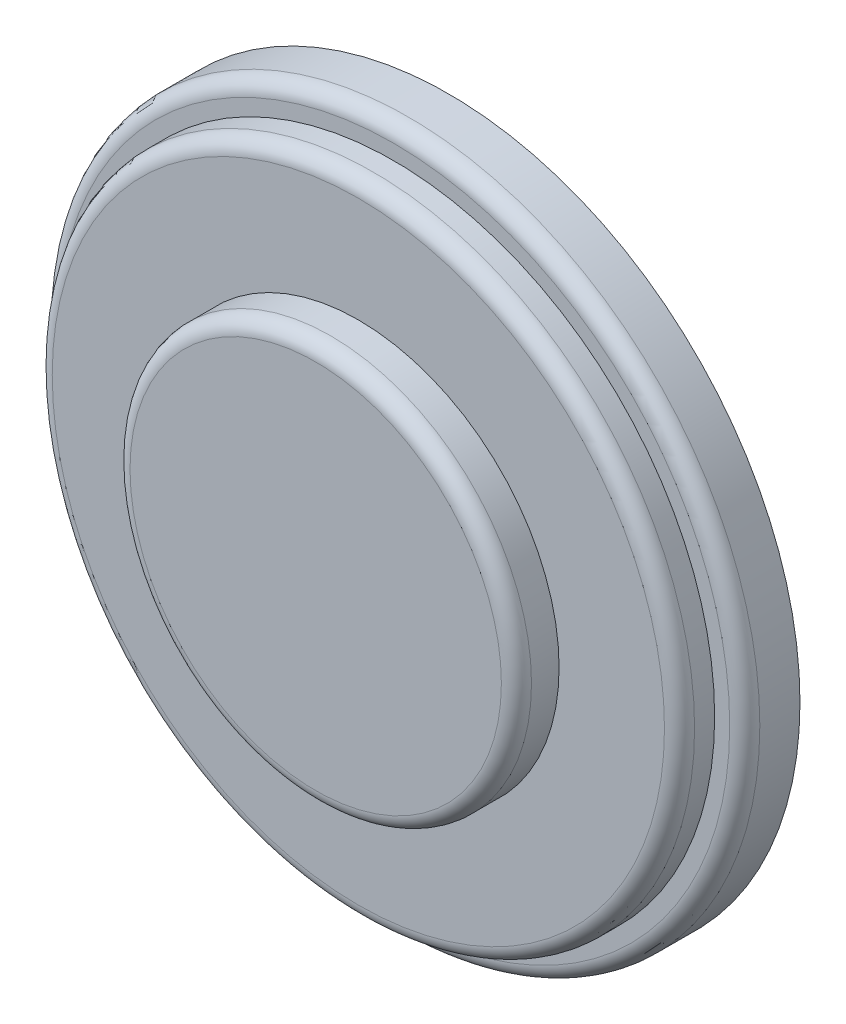
from build123d import *

# Parameters (mm, degrees)
ESQUISSE1_R             = 14
BOSS_EXTRU_1_DEPTH      = 2.2
ESQUISSE2_R             = 12.8
BOSS_EXTRU_2_DEPTH      = 1.4
ESQUISSE3_R             = 8
BOSS_EXTRU_3_DEPTH      = 1.7
ESQUISSE4_R             = 12.5
ENL_V_MAT_EXTRU_1_DEPTH = 1
CONG_1_R                = 0.6


with BuildPart() as part:
    # Esquisse1 → Boss.-Extru.1 (new body)
    with BuildSketch(Plane.XY):
        Circle(ESQUISSE1_R)
    extrude(amount=BOSS_EXTRU_1_DEPTH)

    # Esquisse2 → Boss.-Extru.2 (add)
    with BuildSketch(Plane.XY.offset(2.2)):
        Circle(ESQUISSE2_R)
    extrude(amount=BOSS_EXTRU_2_DEPTH)

    # Esquisse3 → Boss.-Extru.3 (add)
    with BuildSketch(Plane.XY.offset(3.6)):
        Circle(ESQUISSE3_R)
    extrude(amount=BOSS_EXTRU_3_DEPTH)

    # Esquisse4 → Enlèv. mat.-Extru.1 (cut)
    with BuildSketch(Plane(origin=(0, 0, 0), x_dir=(-1, 0, 0), z_dir=(0, 0, -1))):
        Circle(ESQUISSE4_R)
    extrude(amount=-ENL_V_MAT_EXTRU_1_DEPTH, mode=Mode.SUBTRACT)

    # Congé1
    cong_1_edges = [part.edges().sort_by_distance(p)[0] for p in [
        (-8, 0, 5.3),
        (-14, 0, 2.2),
        (-12.8, 0, 3.6),
    ]]
    fillet(cong_1_edges, radius=CONG_1_R)


solid = part.part
